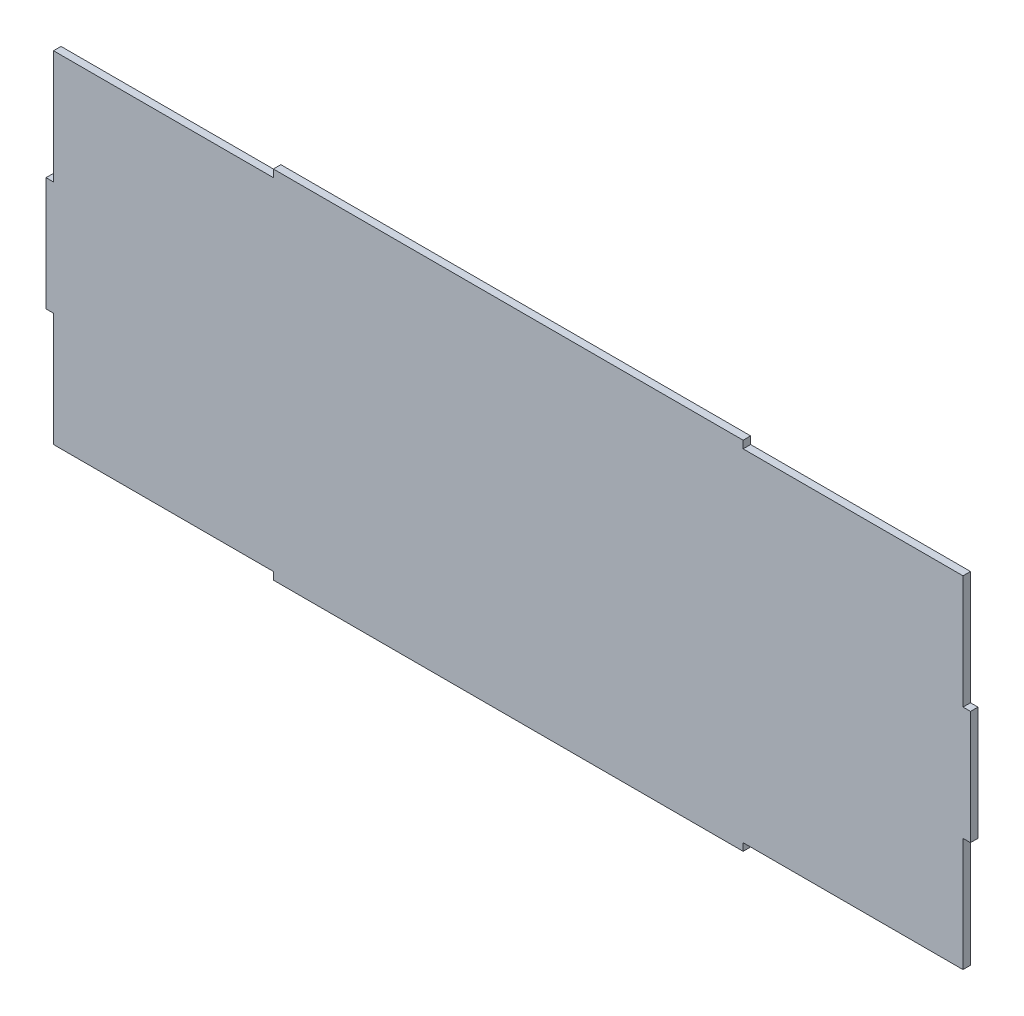
from build123d import *

# Parameters (mm, degrees)
SALIENTE_EXTRUIR1_DEPTH = 3.3


with BuildPart() as part:
    # Croquis1 → Saliente-Extruir1 (new body)
    with BuildSketch(Plane.XY):
        Polygon((-203.3, 25), (-203.3, -25), (-200, -25), (-200, -75), (-103.3, -75), (-103.3, -78.3), (103.3, -78.3), (103.3, -75), (200, -75), (200, -25), (203.3, -25), (203.3, 25), (200, 25), (200, 75), (103.3, 75), (103.3, 78.3), (-103.3, 78.3), (-103.3, 75), (-200, 75), (-200, 25), align=None)
    extrude(amount=SALIENTE_EXTRUIR1_DEPTH)


solid = part.part
